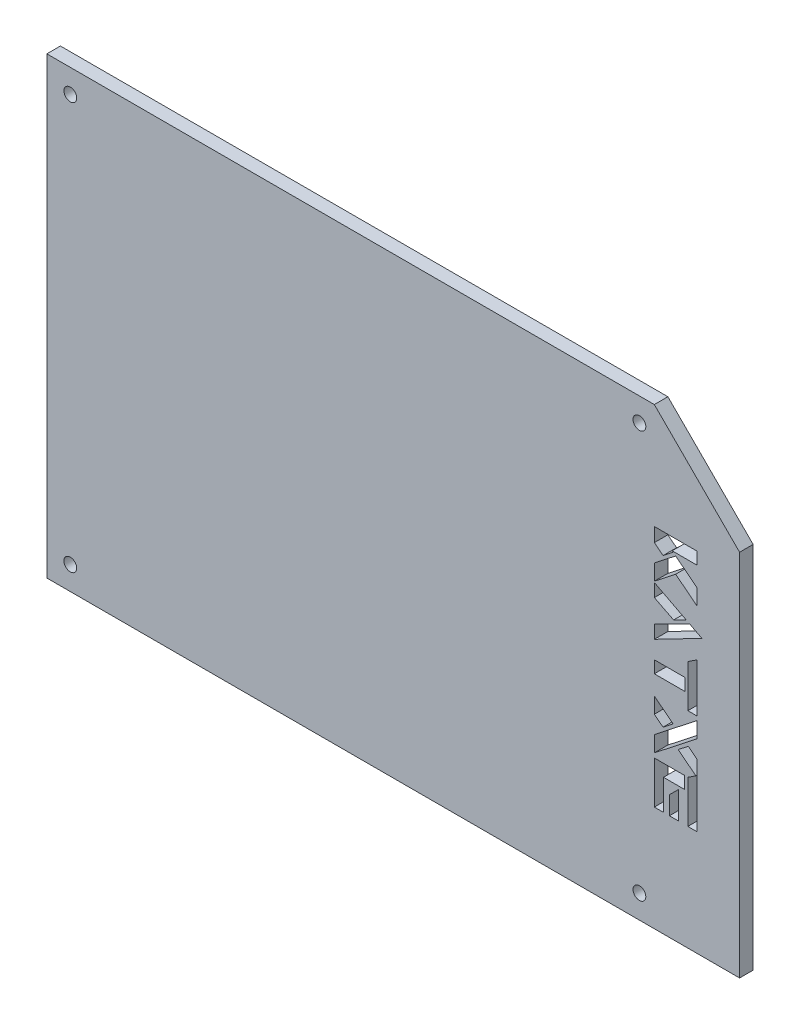
from build123d import *

# Parameters (mm, degrees)
SKETCH1_W           = 140.5
SKETCH1_H           = 106.5
SKETCH1_R           = 1.5
SKETCH1_W_2         = 2
BOSS_EXTRUDE1_DEPTH = 3.175
BOSS_EXTRUDE2_DEPTH = 3.175
SKETCH3_W           = 7.162162162
SKETCH3_H           = 2.850506757
CUT_EXTRUDE1_DEPTH  = 3.175


with BuildPart() as part:
    # Sketch1 → Boss-Extrude1 (new body)
    # profile 1 of 2: a face of its own
    with BuildSketch(Plane.XY):
        Rectangle(SKETCH1_W, SKETCH1_H)
        with Locations((-66.75, -47.75)):
            Circle(SKETCH1_R, mode=Mode.SUBTRACT)
        with Locations((66.75, -47.75)):
            Circle(SKETCH1_R, mode=Mode.SUBTRACT)
        with Locations((-66.75, 47.75)):
            Circle(SKETCH1_R, mode=Mode.SUBTRACT)
        with Locations((66.75, 47.75)):
            Circle(SKETCH1_R, mode=Mode.SUBTRACT)
    # profile 2 of 2: a face of its own
    with BuildSketch(Plane.XY):
        with Locations((-71.25, 0)):
            Rectangle(SKETCH1_W_2, SKETCH1_H)
    extrude(amount=BOSS_EXTRUDE1_DEPTH)

    # Sketch2 → Boss-Extrude2 (add)
    with BuildSketch(Plane.XY):
        Polygon((90.25, 33.25), (70.25, 53.25), (70.25, -53.25), (90.25, -53.25), align=None)
    extrude(amount=BOSS_EXTRUDE2_DEPTH)

    # Sketch3 → Cut-Extrude1 (cut)
    with BuildSketch(Plane.XY.offset(3.175)):
        Polygon((75.25, 21.279560811), (70.25, 17.358530405), (70.25, 21.064189189), (75.25, 24.985219595), (80.25, 21.064189189), (80.25, 17.358530405), align=None)
        Polygon((80.25, 28.475506757), (80.25, 25.625), (74.42652027, 25.625), (74.654560811, 25.447635135), (72.291807432, 23.595861486), (70.25, 25.19847973), (70.25, 28.475506757), align=None)
        Polygon((78.562922297, 12.801942568), (81.413429054, 11.326013514), (70.25, 5.553209459), (70.25, 8.616976351), align=None)
        Polygon((74.764358108, 11.746199324), (70.25, 14.032939189), (70.25, 17.098817568), (77.720439189, 13.234797297), align=None)
        Polygon((78.106841216, -5.014780405), (78.106841216, 4.961993243), (80.25, 6.387246622), (80.25, -5.014780405), align=None)
        with Locations((73.831081081, -0.025337837)):
            Rectangle(SKETCH3_W, SKETCH3_H)
        Polygon((70.25, -17.506334459), (70.25, -13.800675676), (80.25, -5.960726351), (80.25, -9.666385135), align=None)
        Polygon((78.208192568, -12.195945946), (80.25, -13.800675676), (80.25, -17.506334459), (75.843327703, -14.049831081), align=None)
        Polygon((72.291807432, -11.269003378), (70.25, -9.666385135), (70.25, -5.960726351), (74.654560811, -9.41722973), align=None)
        Polygon((78.106841216, -28.528293919), (78.106841216, -18.55152027), (80.25, -17.126266892), (80.25, -28.528293919), align=None)
        Polygon((77.376266892, -18.55152027), (77.376266892, -21.402027027), (72.393158784, -21.402027027), (72.393158784, -28.528293919), (70.25, -28.528293919), (70.25, -18.55152027), align=None)
        Polygon((73.782516892, -28.528293919), (73.782516892, -24.252533784), (75.925675676, -22.113597973), (75.925675676, -28.528293919), align=None)
    extrude(amount=-CUT_EXTRUDE1_DEPTH, mode=Mode.SUBTRACT)


solid = part.part
